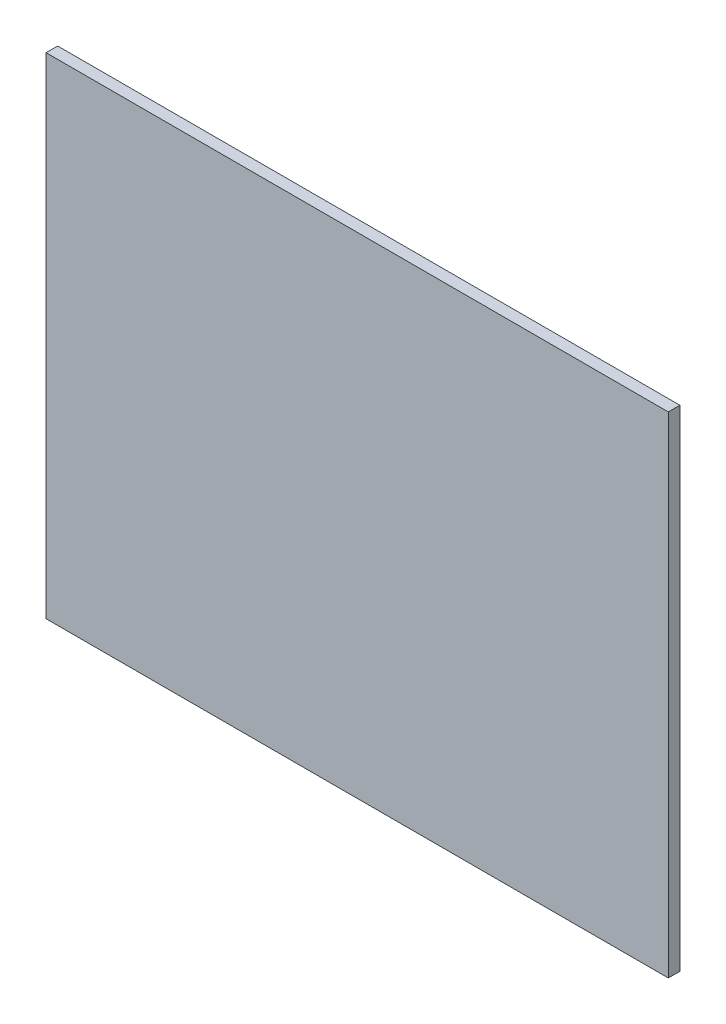
from build123d import *

# Parameters (mm, degrees)
EXTRUDE_START   = 0.8
SKETCH_1_W      = 42.9
SKETCH_1_H      = 33.8
EXTRUDE_1_DEPTH = 0.8


with BuildPart() as part:
    # Эскиз1 → Бобышка-Вытянуть1 (new body)
    with BuildSketch(Plane.XY.offset(EXTRUDE_START)):
        with Locations((-2.05, 0)):
            Rectangle(SKETCH_1_W, SKETCH_1_H)
    extrude(amount=EXTRUDE_1_DEPTH)


solid = part.part
